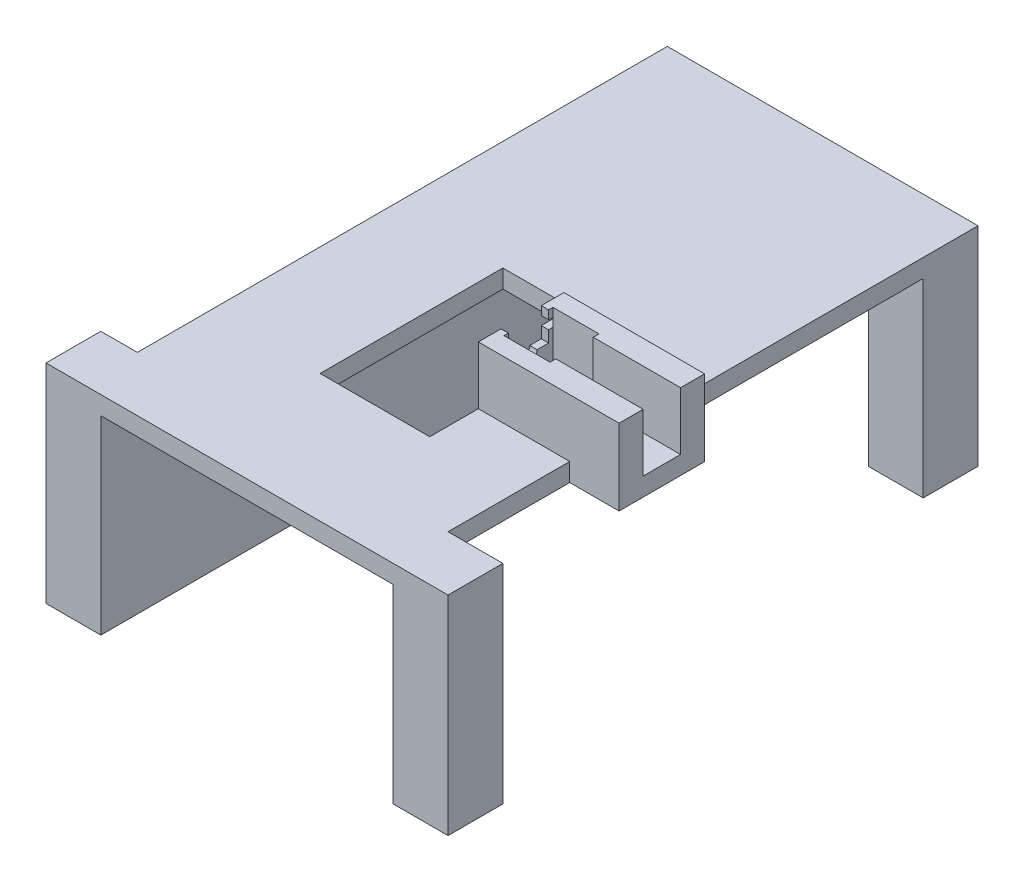
from build123d import *

# Parameters (mm, degrees)
SKETCH1_W                = 101.6
SKETCH1_H                = 152.4
BOSS_EXTRUDE1_DEPTH      = 6.35
SKETCH2_W                = 38.1
SKETCH2_H                = 63.5
CUT_EXTRUDE1_DEPTH       = 92.800885072
BOSS_EXTRUDE3_DEPTH      = 10.0965
BOSS_EXTRUDE3_DEPTH_BACK = 6.35
CUT_EXTRUDE2_REACH       = 105.862
SKETCH6_R                = 3
SKETCH7_W                = 24.005
SKETCH7_H                = 2.009
BOSS_EXTRUDE4_DEPTH      = 16.4465
BOSS_EXTRUDE5_REACH      = 129.401
SKETCH10_W               = 13
SKETCH10_H               = 6.35
CUT_EXTRUDE3_REACH       = 138.165
SKETCH11_W               = 13
SKETCH11_H               = 10.0965
BOSS_EXTRUDE6_DEPTH      = 10
CUT_EXTRUDE4_DEPTH       = 2.54
SKETCH14_W               = 101.6
SKETCH14_H               = 6.35
BOSS_EXTRUDE7_DEPTH      = 50.8
SKETCH15_W               = 19.05
SKETCH15_H               = 19.05
BOSS_EXTRUDE8_DEPTH      = 66.04
SKETCH16_W               = 19.05
SKETCH16_H               = 19.05
BOSS_EXTRUDE9_DEPTH      = 6.35
SKETCH17_W               = 184.15
SKETCH17_H               = 72.39
BOSS_EXTRUDE10_DEPTH     = 6.35


with BuildPart() as part:
    # Sketch1 → Boss-Extrude1 (new body)
    with BuildSketch(Plane(origin=(0, 0, 0), x_dir=(1, 0, 0), z_dir=(0, 1, 0))):
        Rectangle(SKETCH1_W, SKETCH1_H)
    extrude(amount=-BOSS_EXTRUDE1_DEPTH)

    # Sketch2 → Cut-Extrude1 (cut, through all)
    with BuildSketch(Plane(origin=(0, 0, 0), x_dir=(1, 0, 0), z_dir=(0, 1, 0))):
        Rectangle(SKETCH2_W, SKETCH2_H)
    extrude(amount=-CUT_EXTRUDE1_DEPTH, mode=Mode.SUBTRACT)

    # Sketch4 → Boss-Extrude3 (add, two sides: drawn at the far end of the back side and taken through both)
    with BuildSketch(Plane(origin=(0, 0, 0), x_dir=(1, 0, 0), z_dir=(0, 1, 0)).offset(-BOSS_EXTRUDE3_DEPTH_BACK)):
        Polygon((61.595, -8.509), (50.8, -8.509), (50.8, -14.859), (67.945, -14.859), (67.945, 14.859), (50.8, 14.859), (50.8, 8.509), (61.595, 8.509), align=None)
        Polygon((50.8, -8.509), (21.59, -8.509), (21.59, 8.509), (50.8, 8.509), (50.8, 14.859), (19.05, 14.859), (19.05, -14.859), (50.8, -14.859), align=None)
    extrude(amount=BOSS_EXTRUDE3_DEPTH + BOSS_EXTRUDE3_DEPTH_BACK)

    # Sketch6 → Cut-Extrude2 (cut, up to next)
    with BuildSketch(Plane.ZY.offset(-19.05), mode=Mode.PRIVATE) as cut_extrude2_sk1:
        with Locations((0, 10.0965)):
            Circle(SKETCH6_R)
    cut_extrude2_tool1 = extrude(cut_extrude2_sk1.sketch, amount=-CUT_EXTRUDE2_REACH, mode=Mode.PRIVATE) & part.part
    add(cut_extrude2_tool1.solids().sort_by_distance((19.05, 10.0965, 0))[0], mode=Mode.SUBTRACT)

    # Sketch7 → Boss-Extrude4 (add, through all)
    with BuildSketch(Plane(origin=(0, 10.0965, 0), x_dir=(1, 0, 0), z_dir=(0, 1, 0))):
        with Locations((49.5925, 7.5045)):
            Rectangle(SKETCH7_W, SKETCH7_H)
        with Locations((49.5925, -7.5045)):
            Rectangle(SKETCH7_W, SKETCH7_H)
    extrude(amount=-BOSS_EXTRUDE4_DEPTH)

    # Sketch10 → Boss-Extrude5 (add, up to next)
    with BuildSketch(Plane(origin=(50.8, 0, 0), x_dir=(0, 0, -1), z_dir=(1, 0, 0)), mode=Mode.PRIVATE) as boss_extrude5_sk1:
        with Locations((0, -3.175)):
            Rectangle(SKETCH10_W, SKETCH10_H)
    boss_extrude5_tool1 = extrude(boss_extrude5_sk1.sketch, amount=BOSS_EXTRUDE5_REACH, mode=Mode.PRIVATE) - part.part
    add(boss_extrude5_tool1.solids().sort_by_distance((50.8, -3.175, 0))[0])

    # Sketch11 → Cut-Extrude3 (cut, up to next)
    with BuildSketch(Plane.ZY.offset(-61.595), mode=Mode.PRIVATE) as cut_extrude3_sk1:
        with Locations((0, 5.04825)):
            Rectangle(SKETCH11_W, SKETCH11_H)
    cut_extrude3_tool1 = extrude(cut_extrude3_sk1.sketch, amount=-CUT_EXTRUDE3_REACH, mode=Mode.PRIVATE) & part.part
    add(cut_extrude3_tool1.solids().sort_by_distance((61.595, 5.04825, 0))[0], mode=Mode.SUBTRACT)

    # Sketch12 → Boss-Extrude6 (add)
    with BuildSketch(Plane(origin=(0, 10.0965, 0), x_dir=(1, 0, 0), z_dir=(0, 1, 0))):
        Polygon((67.945, -14.859), (67.945, -6.5), (37.59, -6.5), (37.59, -8.509), (21.59, -8.509), (21.59, -3), (19.05, -3), (19.05, -14.859), align=None)
        Polygon((37.59, 6.5), (67.945, 6.5), (67.945, 14.859), (19.05, 14.859), (19.05, 3), (21.59, 3), (21.59, 8.509), (37.59, 8.509), align=None)
    extrude(amount=BOSS_EXTRUDE6_DEPTH)

    # Sketch13 → Cut-Extrude4 (cut)
    with BuildSketch(Plane.ZY.offset(-19.05)):
        Polygon((3, 10.0965), (7, 10.0965), (7, 14.0965), (11, 14.0965), (11, 17.0965), (7, 17.0965), (7, 20.0965), (3, 20.0965), align=None)
    cut_extrude4 = extrude(amount=-CUT_EXTRUDE4_DEPTH, mode=Mode.SUBTRACT)

    # Mirror1: Cut-Extrude4 across plane
    add(cut_extrude4.mirror(Plane.XY), mode=Mode.SUBTRACT)

    # Sketch14 → Boss-Extrude7 (add)
    with BuildSketch(Plane(origin=(0, 0, -76.2), x_dir=(-1, 0, 0), z_dir=(0, 0, -1))):
        with Locations((0, -3.175)):
            Rectangle(SKETCH14_W, SKETCH14_H)
    extrude(amount=BOSS_EXTRUDE7_DEPTH)

    # Sketch15 → Boss-Extrude8 (add)
    with BuildSketch(Plane.XZ.offset(6.35)):
        with Locations((-60.325, 66.675)):
            Rectangle(SKETCH15_W, SKETCH15_H)
        with Locations((60.325, 66.675)):
            Rectangle(SKETCH15_W, SKETCH15_H)
        with Locations((-41.275, -117.475)):
            Rectangle(SKETCH15_W, SKETCH15_H)
        with Locations((41.275, -117.475)):
            Rectangle(SKETCH15_W, SKETCH15_H)
    extrude(amount=BOSS_EXTRUDE8_DEPTH)


with BuildPart() as boss_extrude8_piece_1:
    # of the separate pieces the step leaves, piece 1, a body of its own (boss_extrude8_pieces)
    add(part.part.solids().sort_by_distance((-50.8, 0, 76.2))[0])



with BuildPart() as boss_extrude8_piece_2:
    # of the separate pieces the step leaves, piece 2, a body of its own (boss_extrude8_pieces)
    add(part.part.solids().sort_by_distance((-50.8, -72.39, 76.2))[0])


with BuildPart() as boss_extrude8_piece_3:
    # of the separate pieces the step leaves, piece 3, a body of its own (boss_extrude8_pieces)
    add(part.part.solids().sort_by_distance((50.8, -72.39, 76.2))[0])


with BuildPart() as boss_extrude8_piece_1_1:
    add(boss_extrude8_piece_1.part)

    add(boss_extrude8_piece_2.part)  # Boss-Extrude9 merges Boss-Extrude8 piece 2

    add(boss_extrude8_piece_3.part)  # Boss-Extrude9 merges Boss-Extrude8 piece 3
    # Sketch16 → Boss-Extrude9 (add)
    with BuildSketch(Plane(origin=(0, -6.35, 0), x_dir=(1, 0, 0), z_dir=(0, 1, 0))):
        with Locations((60.325, -66.675)):
            Rectangle(SKETCH16_W, SKETCH16_H)
        with Locations((-60.325, -66.675)):
            Rectangle(SKETCH16_W, SKETCH16_H)
    extrude(amount=BOSS_EXTRUDE9_DEPTH)

    # Sketch17 → Boss-Extrude10 (add)
    with BuildSketch(Plane.ZY.offset(50.8)):
        with Locations((-34.925, -36.195)):
            Rectangle(SKETCH17_W, SKETCH17_H)
    extrude(amount=BOSS_EXTRUDE10_DEPTH)


solid = boss_extrude8_piece_1_1.part
